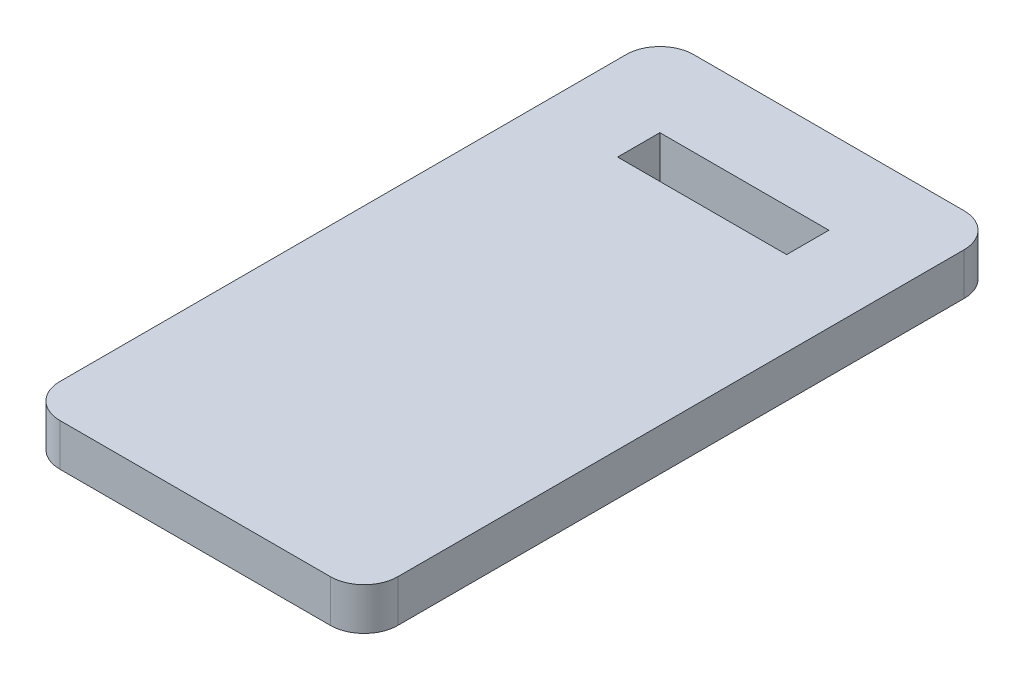
from build123d import *

# Parameters (mm, degrees)
SKETCH1_W           = 25.4
SKETCH1_H           = 47.625
BOSS_EXTRUDE1_DEPTH = 3.175
SKETCH2_W           = 12.7
SKETCH2_H           = 3.175
CUT_EXTRUDE1_DEPTH  = 55.068301712
FILLET1_R           = 2.54


with BuildPart() as part:
    # Sketch1 → Boss-Extrude1 (new body)
    with BuildSketch(Plane(origin=(0, 0, 0), x_dir=(1, 0, 0), z_dir=(0, 1, 0))):
        with Locations((12.7, 23.8125)):
            Rectangle(SKETCH1_W, SKETCH1_H)
    extrude(amount=BOSS_EXTRUDE1_DEPTH)

    # Sketch2 → Cut-Extrude1 (cut, through all)
    with BuildSketch(Plane(origin=(0, 3.175, 0), x_dir=(1, 0, 0), z_dir=(0, 1, 0))):
        with Locations((12.7, 39.6875)):
            Rectangle(SKETCH2_W, SKETCH2_H)
    extrude(amount=-CUT_EXTRUDE1_DEPTH, mode=Mode.SUBTRACT)

    # Fillet1
    fillet1_edges = [part.edges().sort_by_distance(p)[0] for p in [
        (0, 1.5875, -47.625),
        (25.4, 1.5875, -47.625),
        (25.4, 1.5875, 0),
        (0, 1.5875, 0),
    ]]
    fillet(fillet1_edges, radius=FILLET1_R)


solid = part.part
